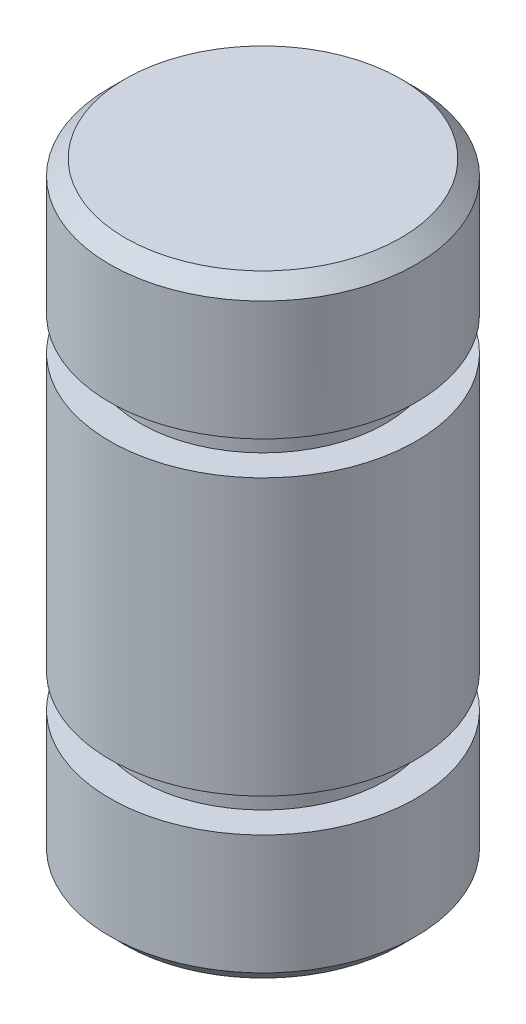
from build123d import *

# Parameters (mm, degrees)
FASE1_SIZE = 0.5


with BuildPart() as part:
    # Skizze1 → Rotation1 (revolve)
    with BuildSketch(Plane.XY, mode=Mode.PRIVATE) as rotation1_sk:
        Polygon((5, 5.5), (5, 14.5), (4, 14.5), (4, 15.6), (5, 15.6), (5, 20), (0, 20), (0, 0), (5, 0), (5, 4.4), (4, 4.4), (4, 5.5), align=None)
    revolve(rotation1_sk.sketch.rotate(Axis((0, 0, 0), (0, 1, 0)), 90), axis=Axis((0, 0, 0), (0, 1, 0)))

    # Fase1
    fase1_edges = [part.edges().sort_by_distance(p)[0] for p in [
        (0, 20, 5),
        (0, 0, 5),
    ]]
    chamfer(fase1_edges, length=FASE1_SIZE)


solid = part.part
